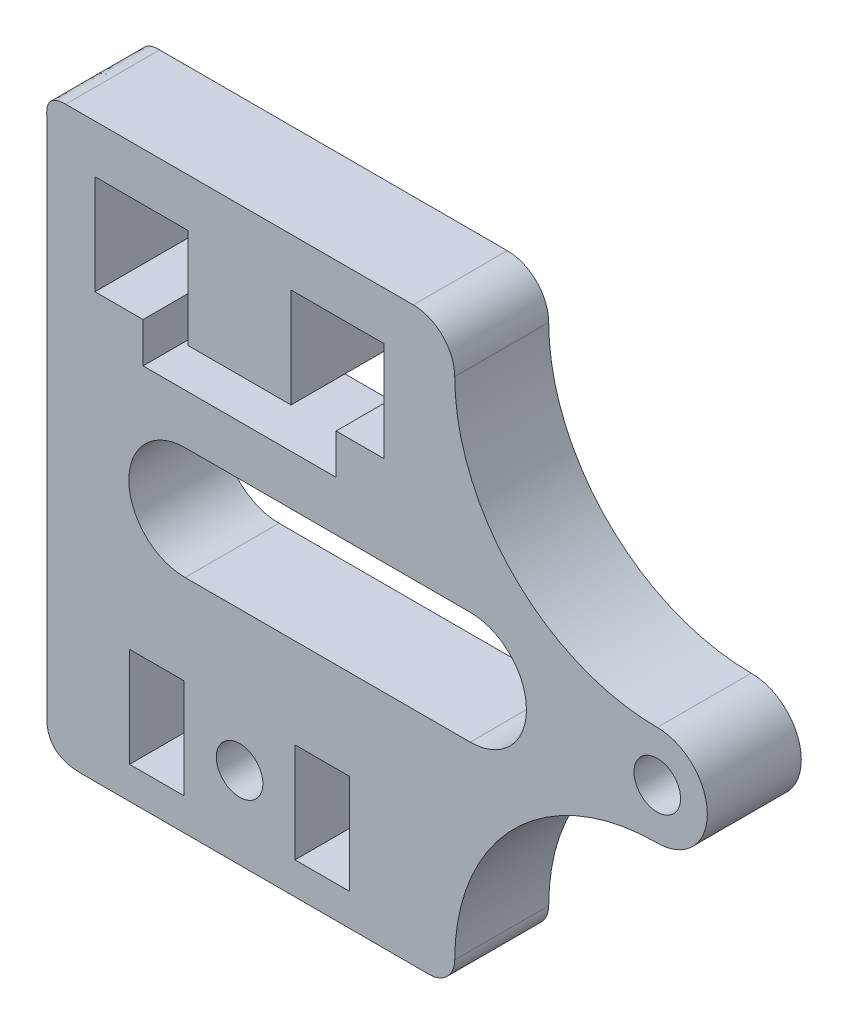
from build123d import *

# Parameters (mm, degrees)
SKETCH1_R           = 1.45
SKETCH1_W           = 3.400011
SKETCH1_H           = 6.2
BOSS_EXTRUDE2_DEPTH = 5.85


with BuildPart() as part:
    # Sketch1 → Boss-Extrude2 (new body)
    with BuildSketch(Plane.XY):
        with BuildLine():
            Line((388.729299875, 562.938903138), (410.374633118, 562.938903138))
            ThreePointArc((410.374633118, 562.938903138), (412.196685191, 562.184184458), (412.95140387, 560.362132386))
            ThreePointArc((412.95140387, 560.362132386), (416.644097047, 551.447182437), (425.559046996, 547.75448926))
            ThreePointArc((425.559046996, 547.75448926), (428.674633119, 544.638903138), (425.559046996, 541.523317015))
            ThreePointArc((425.559046996, 541.523317015), (416.644097047, 537.830623838), (412.95140387, 528.915673889))
            ThreePointArc((412.95140387, 528.915673889), (412.489578409, 527.800728598), (411.374633118, 527.338903138))
            Line((411.374633118, 527.338903138), (389.729299875, 527.338903138))
            add(Edge.make_bspline(
                [(387.555122745, 529.510856868), (387.435461267, 527.338903138), (389.729299875, 527.338903138)],
                knots=[0, 0, 0, 1, 1, 1], degree=2))
            Line((387.555122745, 529.510856868), (387.555122745, 561.765926185))
            add(Edge.make_bspline(
                [(387.555122745, 561.765926185), (387.490498211, 562.938903138), (388.729299875, 562.938903138)],
                knots=[0, 0, 0, 1, 1, 1], degree=2))
        make_face()
        with Locations((425.559046996, 544.638903138)):
            Circle(SKETCH1_R, mode=Mode.SUBTRACT)
        with Locations((399.559046996, 532.438903138)):
            Circle(SKETCH1_R, mode=Mode.SUBTRACT)
        Polygon((405.566920996, 551.238903138), (405.566920996, 553.738903138), (408.562971247, 553.738903138), (408.562971247, 559.938903138), (402.762971247, 559.938903138), (402.762971247, 553.738903138), (396.355122745, 553.738903138), (396.355122745, 559.938903138), (390.555122745, 559.938903138), (390.555122745, 553.738903138), (393.551172996, 553.738903138), (393.551172996, 551.238903138), align=None, mode=Mode.SUBTRACT)
        with Locations((394.409041496, 532.438903138)):
            Rectangle(SKETCH1_W, SKETCH1_H, mode=Mode.SUBTRACT)
        with Locations((404.709052496, 532.438903138)):
            Rectangle(SKETCH1_W, SKETCH1_H, mode=Mode.SUBTRACT)
        with BuildLine():
            Line((396.165690223, 548.138903138), (413.915690223, 548.138903138))
            ThreePointArc((413.915690223, 548.138903138), (417.415690223, 544.638903138), (413.915690223, 541.138903138))
            Line((413.915690223, 541.138903138), (396.165690223, 541.138903138))
            ThreePointArc((396.165690223, 541.138903138), (392.665690223, 544.638903138), (396.165690223, 548.138903138))
        make_face(mode=Mode.SUBTRACT)
    extrude(amount=BOSS_EXTRUDE2_DEPTH)


solid = part.part
